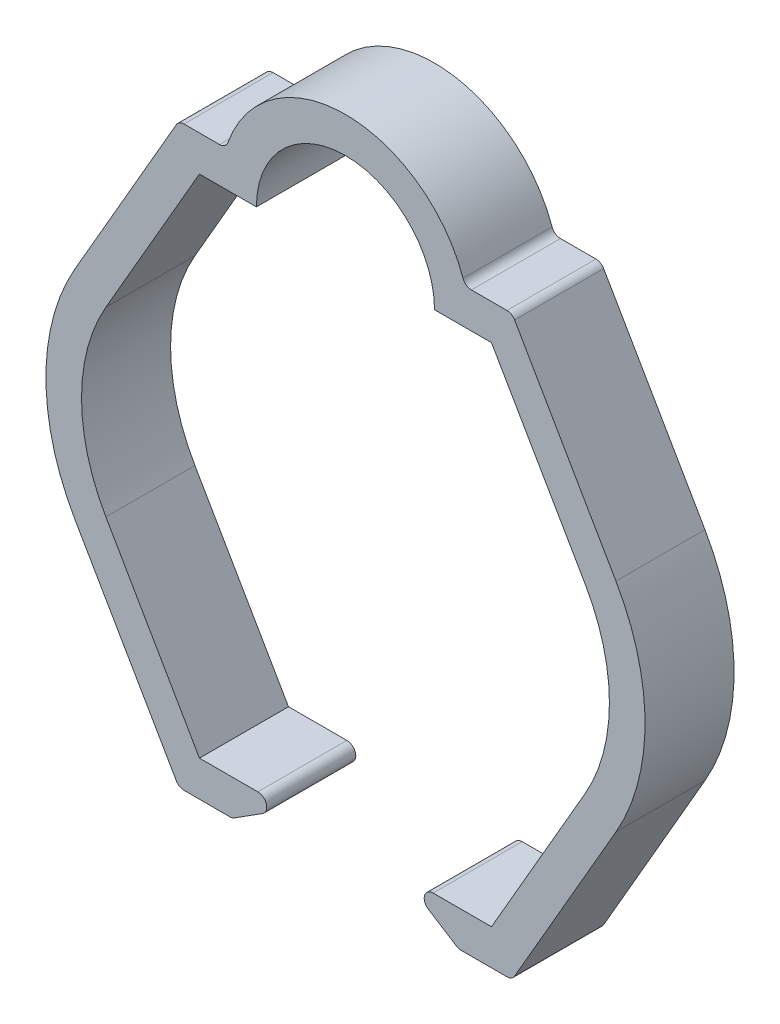
from build123d import *

# Parameters (mm, degrees)
BOSS_EXTRUDE1_DEPTH = 5
FILLET1_R           = 0.5


with BuildPart() as part:
    # Sketch1 → Boss-Extrude1 (new body)
    with BuildSketch(Plane.XY):
        with BuildLine():
            Line((-58.035421321, -29.898049549), (-52.781533871, -38.998049549))
            Line((-52.781533871, -38.998049549), (-47.781533871, -38.998049549))
            Line((-47.781533871, -38.998049549), (-50.93623441, -40.998049549))
            Line((-50.93623441, -40.998049549), (-53.93623441, -40.998049549))
            Line((-53.93623441, -40.998049549), (-59.767472129, -30.898049549))
            ThreePointArc((-59.767472129, -30.898049549), (-61.401962202, -24.798049549), (-59.767472129, -18.698049549))
            Line((-59.767472129, -18.698049549), (-53.93623441, -8.598049549))
            Line((-53.93623441, -8.598049549), (-51.291363981, -8.598049549))
            ThreePointArc((-51.291363981, -8.598049549), (-48.766460182, -4.985563469), (-44.583160049, -3.598049549))
            Line((-44.583160049, -3.598049549), (-44.583160049, -5.598049549))
            ThreePointArc((-44.583160049, -5.598049549), (-48.118693955, -7.062515643), (-49.583160049, -10.598049549))
            Line((-49.583160049, -10.598049549), (-52.781533871, -10.598049549))
            Line((-52.781533871, -10.598049549), (-58.035421321, -19.698049549))
            ThreePointArc((-58.035421321, -19.698049549), (-59.401962202, -24.798049549), (-58.035421321, -29.898049549))
        make_face()
    boss_extrude1 = extrude(amount=BOSS_EXTRUDE1_DEPTH)

    # Mirror1: Boss-Extrude1 across plane
    add(boss_extrude1.mirror(Plane(origin=(-44.583160049, -5.598049549, 5), x_dir=(0, 0, 1), z_dir=(-1, 0, 0))))

    # Fillet1
    fillet1_edges = [part.edges().sort_by_distance(p)[0] for p in [
        (-47.781533871, -38.998049549, 2.5),
        (-50.93623441, -40.998049549, 2.5),
        (-53.93623441, -40.998049549, 2.5),
        (-53.93623441, -8.598049549, 2.5),
        (-51.291363981, -8.598049549, 2.5),
        (-41.384786226, -38.998049549, 2.5),
        (-38.230085688, -40.998049549, 2.5),
        (-35.230085688, -40.998049549, 2.5),
        (-35.230085688, -8.598049549, 2.5),
        (-37.874956116, -8.598049549, 2.5),
    ]]
    fillet(fillet1_edges, radius=FILLET1_R)


solid = part.part
